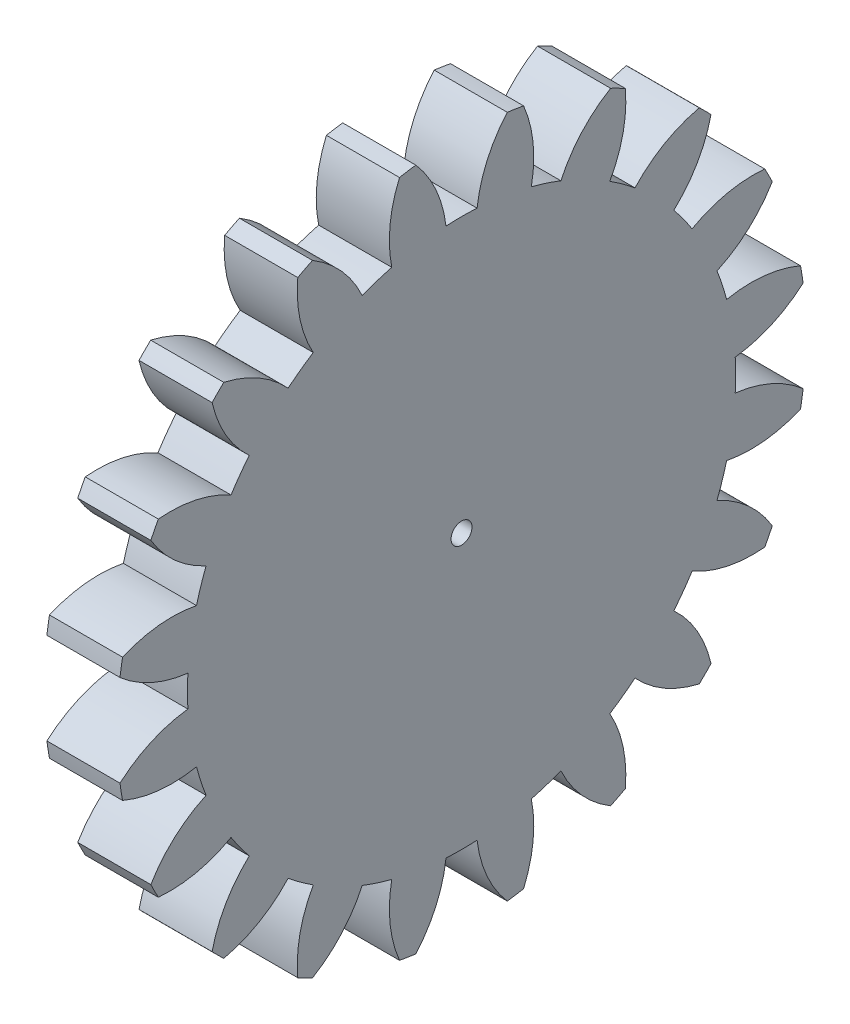
from build123d import *

# Parameters (mm, degrees)
BASPROSKE_W     = 3.5
BASPROSKE_H     = 16.5
TOOTHCUT_DEPTH  = 24.595550428
TEETHCUTS_COUNT = 20
TEETHCUTS_ANGLE = 342
BORSKE_R        = 0.5
BORE_DEPTH      = 50.0000508


with BuildPart() as part:
    # BasProSke → Base-Revolve (revolve)
    with BuildSketch(Plane(origin=(0, 0, 0), x_dir=(1, 0, 0), z_dir=(0, 1, 0)), mode=Mode.PRIVATE) as base_revolve_sk:
        with Locations((1.75, 8.25)):
            Rectangle(BASPROSKE_W, BASPROSKE_H)
    revolve(base_revolve_sk.sketch.rotate(Axis((-10, 0, 0), (1, 0, 0)), 180), axis=Axis((-10, 0, 0), (1, 0, 0)))

    # TooCutSke → ToothCut (cut, through all)
    with BuildSketch(Plane(origin=(0, 0, 0), x_dir=(0, 0, -1), z_dir=(1, 0, 0))):
        with BuildLine():
            ThreePointArc((0.74381438, 13.102904875), (0, 13.124), (-0.74381438, 13.102904875))
            ThreePointArc((-0.74381438, 13.102904875), (-1.226473103, 14.852072512), (-2.209965745, 16.376962373))
            ThreePointArc((-2.209965745, 16.376962373), (0, 16.5254), (2.209965745, 16.376962373))
            ThreePointArc((2.209965745, 16.376962373), (1.226473103, 14.852072512), (0.74381438, 13.102904875))
        make_face()
    toothcut = extrude(amount=TOOTHCUT_DEPTH, mode=Mode.SUBTRACT)

    # TeethCuts: ToothCut ×20 about axis
    teethcuts_axis = Axis((-10, 0, 0), (1, 0, 0))
    for i in range(1, TEETHCUTS_COUNT):
        add(toothcut.rotate(teethcuts_axis, i * TEETHCUTS_ANGLE / (TEETHCUTS_COUNT - 1)), mode=Mode.SUBTRACT)

    # BorSke → Bore (cut, symmetric)
    with BuildSketch(Plane(origin=(0, 0, 0), x_dir=(0, 0, -1), z_dir=(1, 0, 0))):
        with Locations(Location((0, 0, 0), (0, 0, 180))):
            Circle(BORSKE_R)
    extrude(amount=BORE_DEPTH, both=True, mode=Mode.SUBTRACT)


solid = part.part
